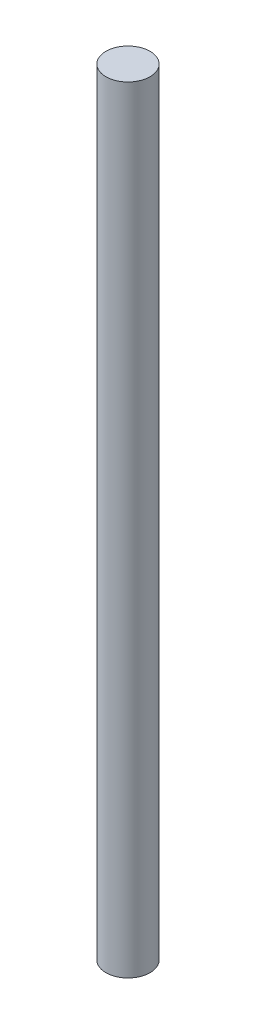
from build123d import *

# Parameters (mm, degrees)
SKETCH1_R           = 1.5875
BOSS_EXTRUDE1_DEPTH = 55.88


with BuildPart() as part:
    # Sketch1 → Boss-Extrude1 (new body)
    with BuildSketch(Plane(origin=(0, 0, 0), x_dir=(1, 0, 0), z_dir=(0, 1, 0))):
        with Locations(Location((-41.164795015, -11.440642282, 0), (0, 0, 270))):
            Circle(SKETCH1_R)
    extrude(amount=BOSS_EXTRUDE1_DEPTH)


solid = part.part
